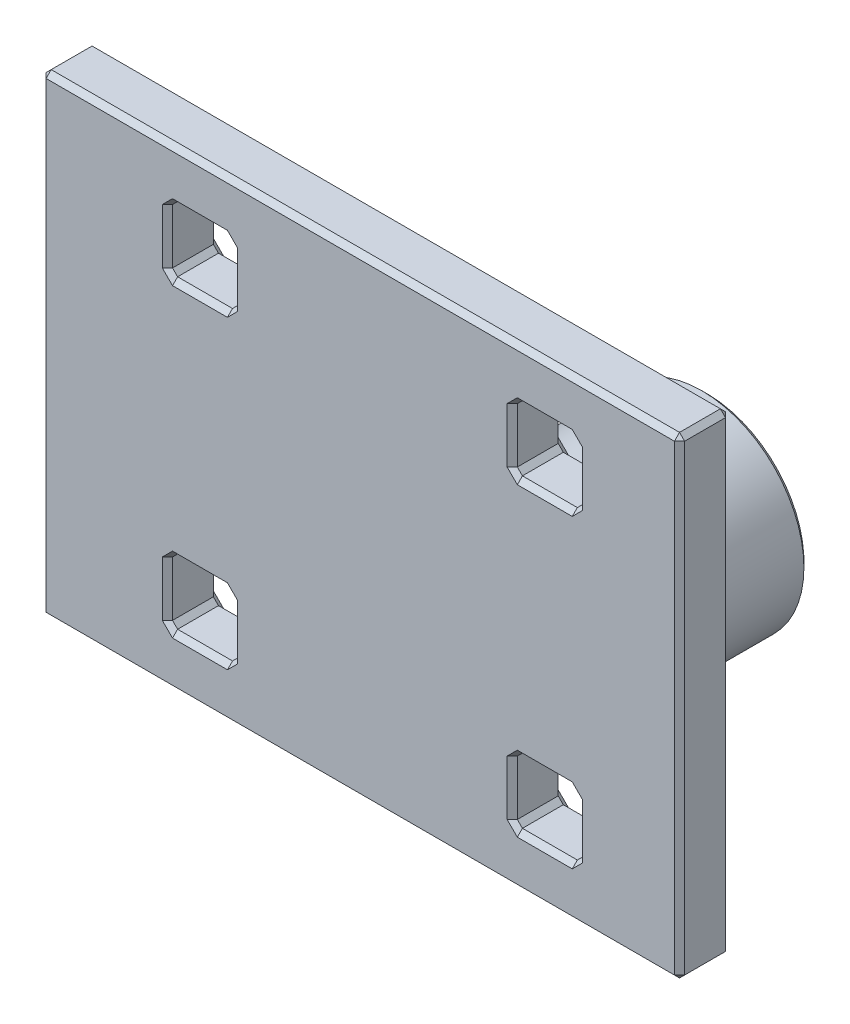
from build123d import *

# Parameters (mm, degrees)
SKIZZE1_W                       = 50
SKIZZE1_H                       = 37
AUFSATZ_LINEAR_AUSTRAGEN1_DEPTH = 4
SKIZZE2_W                       = 5.1
SKIZZE2_H                       = 5.1
SCHNITT_LINEAR_AUSTRAGEN1_DEPTH = 37.293175992
SKIZZE3_R                       = 8
SKIZZE3_R_2                     = 5.060953285
AUFSATZ_LINEAR_AUSTRAGEN2_DEPTH = 11
FASE1_SIZE                      = 0.4
SKIZZE4_R                       = 1.265577593
SCHNITT_LINEAR_AUSTRAGEN2_DEPTH = 100


with BuildPart() as part:
    # Skizze1 → Aufsatz-Linear austragen1 (new body)
    with BuildSketch(Plane.XY):
        with Locations((-2.175232088, -5.221327631)):
            Rectangle(SKIZZE1_W, SKIZZE1_H)
    extrude(amount=AUFSATZ_LINEAR_AUSTRAGEN1_DEPTH)

    # Skizze2 → Schnitt-Linear austragen1 (cut, through all)
    with BuildSketch(Plane(origin=(0, 0, 0), x_dir=(-1, 0, 0), z_dir=(0, 0, -1))):
        with Locations((14.725232088, 6.728672369)):
            Rectangle(SKIZZE2_W, SKIZZE2_H)
        with Locations((-12.274767912, 6.728672369)):
            Rectangle(SKIZZE2_W, SKIZZE2_H)
        with Locations((-12.274767912, -17.171327631)):
            Rectangle(SKIZZE2_W, SKIZZE2_H)
        with Locations((14.725232088, -17.171327631)):
            Rectangle(SKIZZE2_W, SKIZZE2_H)
    extrude(amount=-SCHNITT_LINEAR_AUSTRAGEN1_DEPTH, mode=Mode.SUBTRACT)

    # Skizze3 → Aufsatz-Linear austragen2 (add)
    with BuildSketch(Plane(origin=(0, 0, 0), x_dir=(-1, 0, 0), z_dir=(0, 0, -1))):
        with Locations((-9.965334645, -5.221327631)):
            Circle(SKIZZE3_R)
        with Locations((-9.965334645, -5.221327631)):
            Circle(SKIZZE3_R_2, mode=Mode.SUBTRACT)
    extrude(amount=AUFSATZ_LINEAR_AUSTRAGEN2_DEPTH)

    # Fase1
    fase1_edges = [part.edges().sort_by_distance(p)[0] for p in [
        (-2.175232088, 13.278672369, 4),
        (-27.175232088, -5.221327631, 4),
        (-12.175232088, 6.728672369, 4),
        (-12.175232088, 4.178672369, 2),
        (-14.725232088, 9.278672369, 4),
        (-12.175232088, 9.278672369, 2),
        (-17.275232088, 6.728672369, 4),
        (-17.275232088, 9.278672369, 2),
        (-14.725232088, 4.178672369, 4),
        (-17.275232088, 4.178672369, 2),
        (-12.175232088, 6.728672369, 0),
        (-14.725232088, 4.178672369, 0),
        (-17.275232088, 6.728672369, 0),
        (-14.725232088, 9.278672369, 0),
        (14.824767912, -17.171327631, 4),
        (14.824767912, -19.721327631, 2),
        (12.274767912, -14.621327631, 4),
        (14.824767912, -14.621327631, 2),
        (9.724767912, -17.171327631, 4),
        (9.724767912, -14.621327631, 2),
        (12.274767912, -19.721327631, 4),
        (9.724767912, -19.721327631, 2),
        (14.824767912, -17.171327631, 0),
        (12.274767912, -19.721327631, 0),
        (9.724767912, -17.171327631, 0),
        (12.274767912, -14.621327631, 0),
        (-12.175232088, -17.171327631, 4),
        (-12.175232088, -19.721327631, 2),
        (-14.725232088, -14.621327631, 4),
        (-12.175232088, -14.621327631, 2),
        (-17.275232088, -17.171327631, 4),
        (-17.275232088, -14.621327631, 2),
        (-14.725232088, -19.721327631, 4),
        (-17.275232088, -19.721327631, 2),
        (-12.175232088, -17.171327631, 0),
        (-14.725232088, -19.721327631, 0),
        (-17.275232088, -17.171327631, 0),
        (-14.725232088, -14.621327631, 0),
        (14.824767912, 6.728672369, 4),
        (14.824767912, 4.178672369, 2),
        (12.274767912, 9.278672369, 4),
        (-2.175232088, -23.721327631, 4),
        (-27.175232088, -5.221327631, 0),
        (14.824767912, 9.278672369, 2),
        (9.724767912, 6.728672369, 4),
        (9.724767912, 9.278672369, 2),
        (12.274767912, 4.178672369, 4),
        (9.724767912, 4.178672369, 2),
        (14.824767912, 6.728672369, 0),
        (12.274767912, 4.178672369, 0),
        (9.724767912, 6.728672369, 0),
        (12.274767912, 9.278672369, 0),
        (-2.175232088, 13.278672369, 0),
        (22.824767912, -5.221327631, 0),
        (-2.175232088, -23.721327631, 0),
        (15.02628793, -5.221327631, 0),
        (17.965334645, -5.221327631, -11),
        (17.965334645, -5.221327631, 0),
        (-27.175232088, -23.721327631, 2),
        (15.02628793, -5.221327631, -11),
        (-27.175232088, 13.278672369, 2),
        (22.824767912, 13.278672369, 2),
        (22.824767912, -23.721327631, 2),
        (22.824767912, -5.221327631, 4),
    ]]
    chamfer(fase1_edges, length=FASE1_SIZE)

    # Skizze4 → Schnitt-Linear austragen2 (cut, symmetric)
    with BuildSketch(Plane(origin=(0, 0, 0), x_dir=(1, 0, 0), z_dir=(0, 1, 0))):
        with Locations(Location((9.965334645, 4.963129901, 0), (0, 0, 270))):
            Circle(SKIZZE4_R)
    extrude(amount=SCHNITT_LINEAR_AUSTRAGEN2_DEPTH, both=True, mode=Mode.SUBTRACT)


solid = part.part
